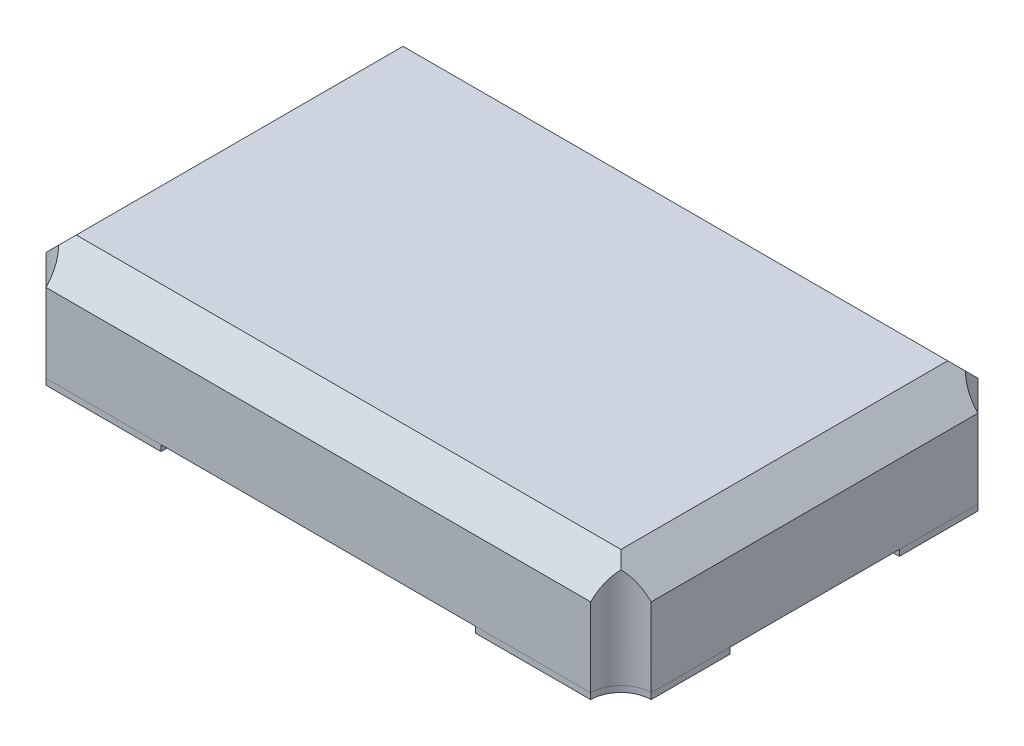
from build123d import *

# Parameters (mm, degrees)
SKETCH1_W        = 5
SKETCH1_H        = 3.2
EXTRUDE1_DEPTH   = 0.9
CHAMFER1_SIZE    = 0.25
SKETCH2_W        = 1.2
SKETCH2_H        = 0.9
EXTRUDE2_DEPTH   = 0.05
EXTRUDE2_2_DEPTH = 0.05
EXTRUDE2_3_DEPTH = 0.05
EXTRUDE2_4_DEPTH = 0.05
SKETCH3_R        = 0.25
EXTRUDE3_DEPTH   = 56.223174198


with BuildPart() as part:
    # Sketch1 → Extrude1 (new body)
    with BuildSketch(Plane(origin=(0, 0, 0), x_dir=(1, 0, 0), z_dir=(0, 1, 0))):
        with Locations((-39.683203209, -34.026869572)):
            Rectangle(SKETCH1_W, SKETCH1_H)
    extrude(amount=EXTRUDE1_DEPTH)

    # Chamfer1
    chamfer1_edges = [part.edges().sort_by_distance(p)[0] for p in [
        (-37.183203209, 0.9, 34.026869572),
        (-39.683203209, 0.9, 32.426869572),
        (-42.183203209, 0.9, 34.026869572),
        (-39.683203209, 0.9, 35.626869572),
    ]]
    chamfer(chamfer1_edges, length=CHAMFER1_SIZE)


with BuildPart() as body_2:
    # Sketch2 → Extrude2 (new body)
    with BuildSketch(Plane.XZ):
        with Locations((-41.583203209, 35.176869572)):
            Rectangle(SKETCH2_W, SKETCH2_H)
    extrude(amount=EXTRUDE2_DEPTH)


with BuildPart() as body_3:
    # Sketch2 → Extrude2 2 (new body)
    with BuildSketch(Plane.XZ):
        with Locations((-37.783203209, 35.176869572)):
            Rectangle(SKETCH2_W, SKETCH2_H)
    extrude(amount=EXTRUDE2_2_DEPTH)


with BuildPart() as body_4:
    # Sketch2 → Extrude2 3 (new body)
    with BuildSketch(Plane.XZ):
        with Locations((-37.783203209, 32.876869572)):
            Rectangle(SKETCH2_W, SKETCH2_H)
    extrude(amount=EXTRUDE2_3_DEPTH)


with BuildPart() as body_5:
    # Sketch2 → Extrude2 4 (new body)
    with BuildSketch(Plane.XZ):
        with Locations((-41.583203209, 32.876869572)):
            Rectangle(SKETCH2_W, SKETCH2_H)
    extrude(amount=EXTRUDE2_4_DEPTH)


with BuildPart() as extrude3_tool:
    # Sketch3 → Extrude3 (new, through all)
    with BuildSketch(Plane(origin=(0, 0.9, 0), x_dir=(1, 0, 0), z_dir=(0, 1, 0))):
        with Locations((-42.183203209, -32.426869572)):
            Circle(SKETCH3_R)
        with Locations((-37.183203209, -32.426869572)):
            Circle(SKETCH3_R)
        with Locations((-37.183203209, -35.626869572)):
            Circle(SKETCH3_R)
        with Locations((-42.183203209, -35.626869572)):
            Circle(SKETCH3_R)
    extrude(amount=-EXTRUDE3_DEPTH)


with BuildPart() as part_1:
    add(part.part)

    # Extrude3: cut by extrude3_tool
    add(extrude3_tool.part, mode=Mode.SUBTRACT)


with BuildPart() as body_2_1:
    add(body_2.part)

    # Extrude3: cut by extrude3_tool
    add(extrude3_tool.part, mode=Mode.SUBTRACT)


with BuildPart() as body_3_1:
    add(body_3.part)

    # Extrude3: cut by extrude3_tool
    add(extrude3_tool.part, mode=Mode.SUBTRACT)


with BuildPart() as body_4_1:
    add(body_4.part)

    # Extrude3: cut by extrude3_tool
    add(extrude3_tool.part, mode=Mode.SUBTRACT)


with BuildPart() as body_5_1:
    add(body_5.part)

    # Extrude3: cut by extrude3_tool
    add(extrude3_tool.part, mode=Mode.SUBTRACT)


solid = Compound([part_1.part, body_2_1.part, body_3_1.part, body_4_1.part, body_5_1.part])
